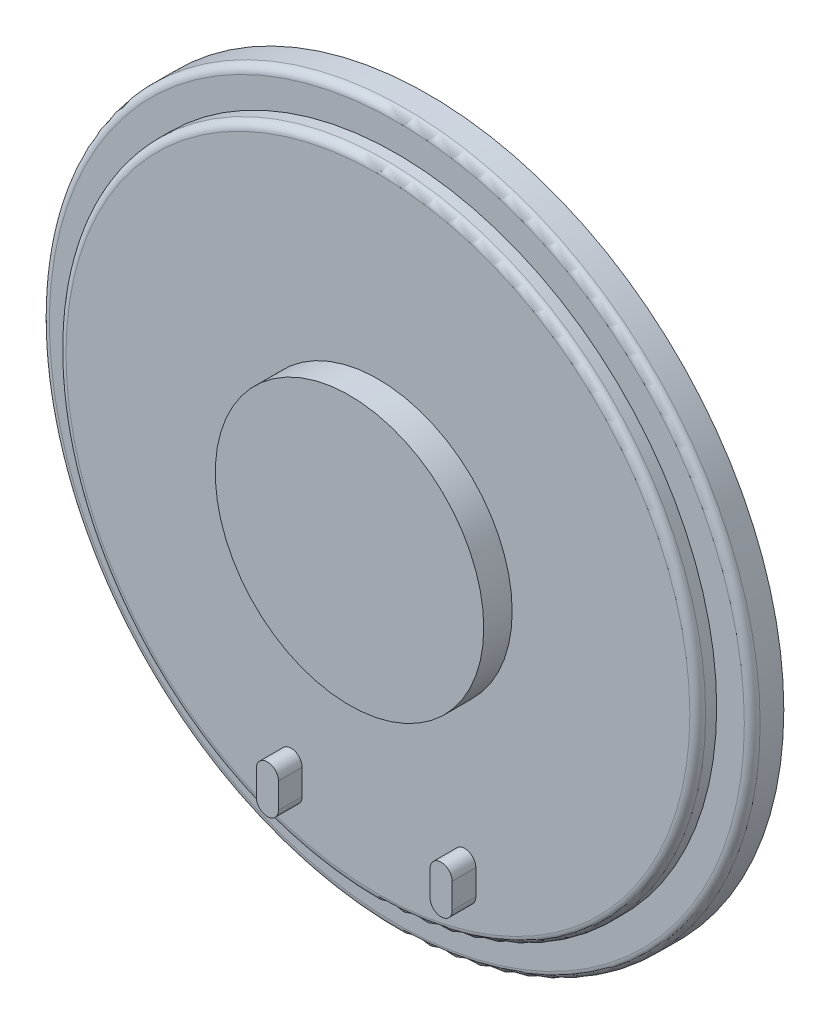
from build123d import *

# Parameters (mm, degrees)
SKETCH_1_R          = 22.5
EXTRUDE_1_DEPTH     = 5
SKETCH_2_OUTSIDE_W  = 59.768
SKETCH_2_OUTSIDE_H  = 59.768
SKETCH_2_OUTSIDE_R  = 20.25
CUT_EXTRUDE_1_DEPTH = 3
SKETCH_3_OUTSIDE_W  = 59.768
SKETCH_3_OUTSIDE_H  = 59.768
SKETCH_3_OUTSIDE_R  = 8.5
CUT_EXTRUDE_2_DEPTH = 1.8
CUT_EXTRUDE_START   = -1.8
SKETCH_4_R          = 20.25
CUT_EXTRUDE_3_DEPTH = 1.8
FILLET_1_R          = 1.5
FILLET_2_R          = 0.5
FILLET_3_R          = 0.5
EXTRUDE_978_DEPTH   = 1.5


with BuildPart() as part:
    # 草图1 → 拉伸1 (new body)
    with BuildSketch(Plane.XY):
        Circle(SKETCH_1_R)
    extrude(amount=EXTRUDE_1_DEPTH)

    # 草图2 outside → 切除-拉伸1 (cut)
    with BuildSketch(Plane.XY.offset(5)):
        Rectangle(SKETCH_2_OUTSIDE_W, SKETCH_2_OUTSIDE_H)
        Circle(SKETCH_2_OUTSIDE_R, mode=Mode.SUBTRACT)
    extrude(amount=-CUT_EXTRUDE_1_DEPTH, mode=Mode.SUBTRACT)

    # 草图3 outside → 切除-拉伸2 (cut)
    with BuildSketch(Plane.XY.offset(5)):
        Rectangle(SKETCH_3_OUTSIDE_W, SKETCH_3_OUTSIDE_H)
        Circle(SKETCH_3_OUTSIDE_R, mode=Mode.SUBTRACT)
    extrude(amount=-CUT_EXTRUDE_2_DEPTH, mode=Mode.SUBTRACT)

    # 草图4 → 切除-拉伸3 (cut)
    with BuildSketch(Plane(origin=(0, 0, 0), x_dir=(-1, 0, 0), z_dir=(0, 0, -1)).offset(CUT_EXTRUDE_START)):
        with Locations(Location((0, 0, 0), (0, 0, 180))):
            Circle(SKETCH_4_R)
    extrude(amount=CUT_EXTRUDE_3_DEPTH, mode=Mode.SUBTRACT)

    # 圆角1
    fillet_1_edges = [part.edges().sort_by_distance(p)[0] for p in [
        (-20.25, 0, 0),
    ]]
    fillet(fillet_1_edges, radius=FILLET_1_R)

    # 圆角2
    fillet_2_edges = [part.edges().sort_by_distance(p)[0] for p in [
        (-22.5, 0, 2),
    ]]
    fillet(fillet_2_edges, radius=FILLET_2_R)

    # 圆角3
    fillet_3_edges = [part.edges().sort_by_distance(p)[0] for p in [
        (-20.25, 0, 3.2),
    ]]
    fillet(fillet_3_edges, radius=FILLET_3_R)

    # 草图5 → Extrude 978 (add)
    with BuildSketch(Plane.XY.offset(3.2)):
        with BuildLine():
            Line((-4.8, -15.2), (-4.8, -16.8))
            ThreePointArc((-4.8, -16.8), (-5.5, -17.5), (-6.2, -16.8))
            Line((-6.2, -16.8), (-6.2, -15.2))
            ThreePointArc((-6.2, -15.2), (-5.5, -14.5), (-4.8, -15.2))
        make_face()
        with BuildLine():
            Line((4.8, -15.2), (4.8, -16.8))
            ThreePointArc((4.8, -16.8), (5.5, -17.5), (6.2, -16.8))
            Line((6.2, -16.8), (6.2, -15.2))
            ThreePointArc((6.2, -15.2), (5.5, -14.5), (4.8, -15.2))
        make_face()
    extrude(amount=EXTRUDE_978_DEPTH)


solid = part.part
